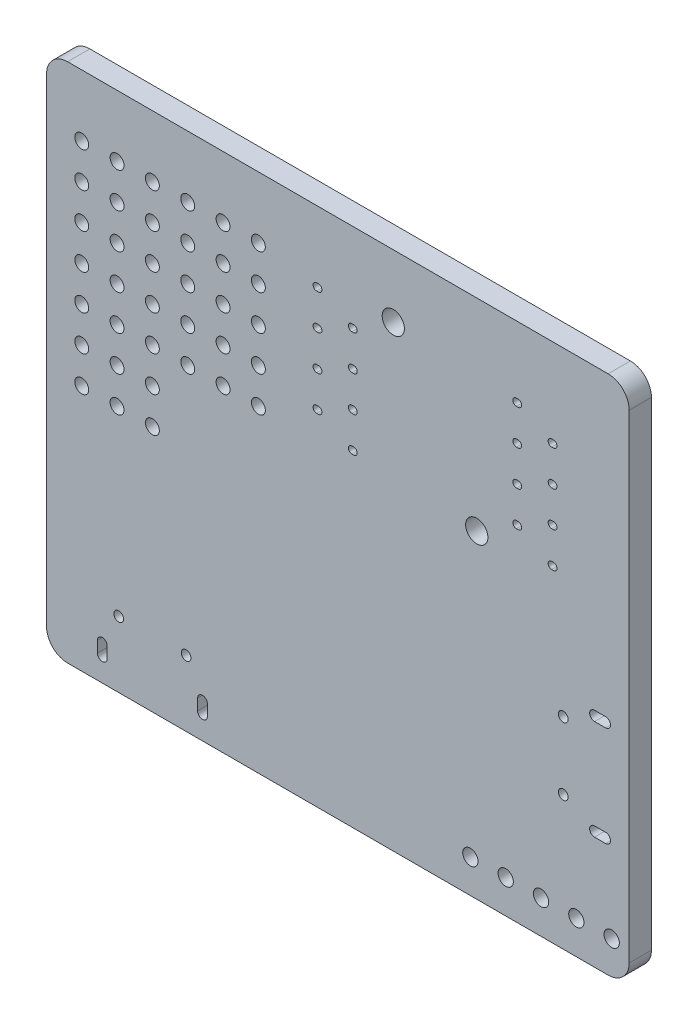
from build123d import *

# Parameters (mm, degrees)
SKETCH1_R           = 0.50000127
SKETCH1_R_2         = 0.80000254
SKETCH1_R_3         = 0.3500127
SKETCH1_R_4         = 0.5500127
BOSS_EXTRUDE1_DEPTH = 1.6000508


with BuildPart() as part:
    # Sketch1 → Boss-Extrude1 (new body)
    with BuildSketch(Plane(origin=(0, 0, 0), x_dir=(-1, 0, 0), z_dir=(0, 0, -1))):
        with BuildLine():
            Line((-40.386080772, 0.012700025), (-1.524003048, 0.012700025))
            ThreePointArc((-1.524003048, 0.012700025), (-0.455350432, 0.455350432), (-0.012700025, 1.524003048))
            Line((-0.012700025, 1.524003048), (-0.012700025, 35.941071882))
            ThreePointArc((-0.012700025, 35.941071882), (-0.455350432, 37.009724498), (-1.524003048, 37.452374905))
            Line((-1.524003048, 37.452374905), (-40.386080772, 37.452374905))
            ThreePointArc((-40.386080772, 37.452374905), (-41.454733388, 37.009724498), (-41.897383795, 35.941071882))
            Line((-41.897383795, 35.941071882), (-41.897383795, 1.524003048))
            ThreePointArc((-41.897383795, 1.524003048), (-41.454733388, 0.455350432), (-40.386080772, 0.012700025))
        make_face()
        with Locations(Location((-2.54000508, 33.02006604, 0), (0, 0, 180))):
            Circle(SKETCH1_R, mode=Mode.SUBTRACT)
        with Locations(Location((-5.08001016, 33.02006604, 0), (0, 0, 180))):
            Circle(SKETCH1_R, mode=Mode.SUBTRACT)
        with Locations(Location((-2.54000508, 30.48006096, 0), (0, 0, 180))):
            Circle(SKETCH1_R, mode=Mode.SUBTRACT)
        with Locations(Location((-5.08001016, 30.48006096, 0), (0, 0, 180))):
            Circle(SKETCH1_R, mode=Mode.SUBTRACT)
        with Locations(Location((-7.62001524, 33.02006604, 0), (0, 0, 180))):
            Circle(SKETCH1_R, mode=Mode.SUBTRACT)
        with Locations(Location((-10.16002032, 33.02006604, 0), (0, 0, 180))):
            Circle(SKETCH1_R, mode=Mode.SUBTRACT)
        with Locations(Location((-7.62001524, 30.48006096, 0), (0, 0, 180))):
            Circle(SKETCH1_R, mode=Mode.SUBTRACT)
        with Locations(Location((-10.16002032, 30.48006096, 0), (0, 0, 180))):
            Circle(SKETCH1_R, mode=Mode.SUBTRACT)
        with Locations(Location((-2.54000508, 27.94005588, 0), (0, 0, 180))):
            Circle(SKETCH1_R, mode=Mode.SUBTRACT)
        with Locations(Location((-5.08001016, 27.94005588, 0), (0, 0, 180))):
            Circle(SKETCH1_R, mode=Mode.SUBTRACT)
        with Locations(Location((-7.62001524, 27.94005588, 0), (0, 0, 180))):
            Circle(SKETCH1_R, mode=Mode.SUBTRACT)
        with Locations(Location((-10.16002032, 27.94005588, 0), (0, 0, 180))):
            Circle(SKETCH1_R, mode=Mode.SUBTRACT)
        with Locations(Location((-12.7000254, 33.02006604, 0), (0, 0, 180))):
            Circle(SKETCH1_R, mode=Mode.SUBTRACT)
        with Locations(Location((-15.24003048, 33.02006604, 0), (0, 0, 180))):
            Circle(SKETCH1_R, mode=Mode.SUBTRACT)
        with Locations(Location((-12.7000254, 30.48006096, 0), (0, 0, 180))):
            Circle(SKETCH1_R, mode=Mode.SUBTRACT)
        with Locations(Location((-15.24003048, 30.48006096, 0), (0, 0, 180))):
            Circle(SKETCH1_R, mode=Mode.SUBTRACT)
        with Locations(Location((-12.7000254, 27.94005588, 0), (0, 0, 180))):
            Circle(SKETCH1_R, mode=Mode.SUBTRACT)
        with Locations(Location((-15.24003048, 27.94005588, 0), (0, 0, 180))):
            Circle(SKETCH1_R, mode=Mode.SUBTRACT)
        with Locations(Location((-2.54000508, 25.4000508, 0), (0, 0, 180))):
            Circle(SKETCH1_R, mode=Mode.SUBTRACT)
        with Locations(Location((-5.08001016, 25.4000508, 0), (0, 0, 180))):
            Circle(SKETCH1_R, mode=Mode.SUBTRACT)
        with Locations(Location((-2.54000508, 22.86004572, 0), (0, 0, 180))):
            Circle(SKETCH1_R, mode=Mode.SUBTRACT)
        with Locations(Location((-5.08001016, 22.86004572, 0), (0, 0, 180))):
            Circle(SKETCH1_R, mode=Mode.SUBTRACT)
        with Locations(Location((-7.62001524, 25.4000508, 0), (0, 0, 180))):
            Circle(SKETCH1_R, mode=Mode.SUBTRACT)
        with Locations(Location((-10.16002032, 25.4000508, 0), (0, 0, 180))):
            Circle(SKETCH1_R, mode=Mode.SUBTRACT)
        with Locations(Location((-7.62001524, 22.86004572, 0), (0, 0, 180))):
            Circle(SKETCH1_R, mode=Mode.SUBTRACT)
        with Locations(Location((-10.16002032, 22.86004572, 0), (0, 0, 180))):
            Circle(SKETCH1_R, mode=Mode.SUBTRACT)
        with Locations(Location((-2.54000508, 20.32004064, 0), (0, 0, 180))):
            Circle(SKETCH1_R, mode=Mode.SUBTRACT)
        with Locations(Location((-5.08001016, 20.32004064, 0), (0, 0, 180))):
            Circle(SKETCH1_R, mode=Mode.SUBTRACT)
        with Locations(Location((-2.54000508, 17.78003556, 0), (0, 0, 180))):
            Circle(SKETCH1_R, mode=Mode.SUBTRACT)
        with Locations(Location((-5.08001016, 17.78003556, 0), (0, 0, 180))):
            Circle(SKETCH1_R, mode=Mode.SUBTRACT)
        with Locations(Location((-7.62001524, 20.32004064, 0), (0, 0, 180))):
            Circle(SKETCH1_R, mode=Mode.SUBTRACT)
        with Locations(Location((-7.62001524, 17.78003556, 0), (0, 0, 180))):
            Circle(SKETCH1_R, mode=Mode.SUBTRACT)
        with Locations(Location((-12.7000254, 25.4000508, 0), (0, 0, 180))):
            Circle(SKETCH1_R, mode=Mode.SUBTRACT)
        with Locations(Location((-15.24003048, 25.4000508, 0), (0, 0, 180))):
            Circle(SKETCH1_R, mode=Mode.SUBTRACT)
        with Locations(Location((-12.7000254, 22.86004572, 0), (0, 0, 180))):
            Circle(SKETCH1_R, mode=Mode.SUBTRACT)
        with Locations(Location((-15.24003048, 22.86004572, 0), (0, 0, 180))):
            Circle(SKETCH1_R, mode=Mode.SUBTRACT)
        with Locations(Location((-24.9400508, 32.94006604, 0), (0, 0, 180))):
            Circle(SKETCH1_R_2, mode=Mode.SUBTRACT)
        with Locations(Location((-30.94006096, 22.94004572, 0), (0, 0, 180))):
            Circle(SKETCH1_R_2, mode=Mode.SUBTRACT)
        with Locations(Location((-5.19502159, 4.754025908, 0), (0, 0, 180))):
            Circle(SKETCH1_R_3, mode=Mode.SUBTRACT)
        with Locations(Location((-10.04500889, 4.754025908, 0), (0, 0, 180))):
            Circle(SKETCH1_R_3, mode=Mode.SUBTRACT)
        with Locations(Location((-37.156057912, 14.49001778, 0), (0, 0, 180))):
            Circle(SKETCH1_R_3, mode=Mode.SUBTRACT)
        with Locations(Location((-37.156057912, 9.64003048, 0), (0, 0, 180))):
            Circle(SKETCH1_R_3, mode=Mode.SUBTRACT)
        with Locations(Location((-30.48006096, 2.413004826, 0), (0, 0, 180))):
            Circle(SKETCH1_R_4, mode=Mode.SUBTRACT)
        with Locations(Location((-33.02006604, 2.413004826, 0), (0, 0, 180))):
            Circle(SKETCH1_R_4, mode=Mode.SUBTRACT)
        with Locations(Location((-35.56007112, 2.413004826, 0), (0, 0, 180))):
            Circle(SKETCH1_R_4, mode=Mode.SUBTRACT)
        with Locations(Location((-38.1000762, 2.413004826, 0), (0, 0, 180))):
            Circle(SKETCH1_R_4, mode=Mode.SUBTRACT)
        with Locations(Location((-40.64008128, 2.413004826, 0), (0, 0, 180))):
            Circle(SKETCH1_R_4, mode=Mode.SUBTRACT)
        with BuildLine():
            Line((-19.553538227, 32.639065278), (-19.426537973, 32.639065278))
            ThreePointArc((-19.426537973, 32.639065278), (-19.172537465, 32.38506477), (-19.426537973, 32.131064262))
            Line((-19.426537973, 32.131064262), (-19.553538227, 32.131064262))
            ThreePointArc((-19.553538227, 32.131064262), (-19.807538735, 32.38506477), (-19.553538227, 32.639065278))
        make_face(mode=Mode.SUBTRACT)
        with BuildLine():
            Line((-19.553538227, 30.099060198), (-19.426537973, 30.099060198))
            ThreePointArc((-19.426537973, 30.099060198), (-19.172537465, 29.84505969), (-19.426537973, 29.591059182))
            Line((-19.426537973, 29.591059182), (-19.553538227, 29.591059182))
            ThreePointArc((-19.553538227, 29.591059182), (-19.807538735, 29.84505969), (-19.553538227, 30.099060198))
        make_face(mode=Mode.SUBTRACT)
        with BuildLine():
            Line((-19.553538227, 27.559055118), (-19.426537973, 27.559055118))
            ThreePointArc((-19.426537973, 27.559055118), (-19.172537465, 27.30505461), (-19.426537973, 27.051054102))
            Line((-19.426537973, 27.051054102), (-19.553538227, 27.051054102))
            ThreePointArc((-19.553538227, 27.051054102), (-19.807538735, 27.30505461), (-19.553538227, 27.559055118))
        make_face(mode=Mode.SUBTRACT)
        with BuildLine():
            Line((-19.553538227, 25.019050038), (-19.426537973, 25.019050038))
            ThreePointArc((-19.426537973, 25.019050038), (-19.172537465, 24.76504953), (-19.426537973, 24.511049022))
            Line((-19.426537973, 24.511049022), (-19.553538227, 24.511049022))
            ThreePointArc((-19.553538227, 24.511049022), (-19.807538735, 24.76504953), (-19.553538227, 25.019050038))
        make_face(mode=Mode.SUBTRACT)
        with BuildLine():
            Line((-22.093543307, 31.369062738), (-21.966543053, 31.369062738))
            ThreePointArc((-21.966543053, 31.369062738), (-21.712542545, 31.11506223), (-21.966543053, 30.861061722))
            Line((-21.966543053, 30.861061722), (-22.093543307, 30.861061722))
            ThreePointArc((-22.093543307, 30.861061722), (-22.347543815, 31.11506223), (-22.093543307, 31.369062738))
        make_face(mode=Mode.SUBTRACT)
        with BuildLine():
            Line((-22.093543307, 28.829057658), (-21.966543053, 28.829057658))
            ThreePointArc((-21.966543053, 28.829057658), (-21.712542545, 28.57505715), (-21.966543053, 28.321056642))
            Line((-21.966543053, 28.321056642), (-22.093543307, 28.321056642))
            ThreePointArc((-22.093543307, 28.321056642), (-22.347543815, 28.57505715), (-22.093543307, 28.829057658))
        make_face(mode=Mode.SUBTRACT)
        with BuildLine():
            Line((-22.093543307, 26.289052578), (-21.966543053, 26.289052578))
            ThreePointArc((-21.966543053, 26.289052578), (-21.712542545, 26.03505207), (-21.966543053, 25.781051562))
            Line((-21.966543053, 25.781051562), (-22.093543307, 25.781051562))
            ThreePointArc((-22.093543307, 25.781051562), (-22.347543815, 26.03505207), (-22.093543307, 26.289052578))
        make_face(mode=Mode.SUBTRACT)
        with BuildLine():
            Line((-33.913568707, 32.639065278), (-33.786568453, 32.639065278))
            ThreePointArc((-33.786568453, 32.639065278), (-33.532567945, 32.38506477), (-33.786568453, 32.131064262))
            Line((-33.786568453, 32.131064262), (-33.913568707, 32.131064262))
            ThreePointArc((-33.913568707, 32.131064262), (-34.167569215, 32.38506477), (-33.913568707, 32.639065278))
        make_face(mode=Mode.SUBTRACT)
        with BuildLine():
            Line((-33.913568707, 30.099060198), (-33.786568453, 30.099060198))
            ThreePointArc((-33.786568453, 30.099060198), (-33.532567945, 29.84505969), (-33.786568453, 29.591059182))
            Line((-33.786568453, 29.591059182), (-33.913568707, 29.591059182))
            ThreePointArc((-33.913568707, 29.591059182), (-34.167569215, 29.84505969), (-33.913568707, 30.099060198))
        make_face(mode=Mode.SUBTRACT)
        with BuildLine():
            Line((-36.453573787, 31.369062738), (-36.326573533, 31.369062738))
            ThreePointArc((-36.326573533, 31.369062738), (-36.072573025, 31.11506223), (-36.326573533, 30.861061722))
            Line((-36.326573533, 30.861061722), (-36.453573787, 30.861061722))
            ThreePointArc((-36.453573787, 30.861061722), (-36.707574295, 31.11506223), (-36.453573787, 31.369062738))
        make_face(mode=Mode.SUBTRACT)
        with BuildLine():
            Line((-33.913568707, 27.559055118), (-33.786568453, 27.559055118))
            ThreePointArc((-33.786568453, 27.559055118), (-33.532567945, 27.30505461), (-33.786568453, 27.051054102))
            Line((-33.786568453, 27.051054102), (-33.913568707, 27.051054102))
            ThreePointArc((-33.913568707, 27.051054102), (-34.167569215, 27.30505461), (-33.913568707, 27.559055118))
        make_face(mode=Mode.SUBTRACT)
        with BuildLine():
            Line((-36.453573787, 28.829057658), (-36.326573533, 28.829057658))
            ThreePointArc((-36.326573533, 28.829057658), (-36.072573025, 28.57505715), (-36.326573533, 28.321056642))
            Line((-36.326573533, 28.321056642), (-36.453573787, 28.321056642))
            ThreePointArc((-36.453573787, 28.321056642), (-36.707574295, 28.57505715), (-36.453573787, 28.829057658))
        make_face(mode=Mode.SUBTRACT)
        with BuildLine():
            Line((-36.453573787, 26.289052578), (-36.326573533, 26.289052578))
            ThreePointArc((-36.326573533, 26.289052578), (-36.072573025, 26.03505207), (-36.326573533, 25.781051562))
            Line((-36.326573533, 25.781051562), (-36.453573787, 25.781051562))
            ThreePointArc((-36.453573787, 25.781051562), (-36.707574295, 26.03505207), (-36.453573787, 26.289052578))
        make_face(mode=Mode.SUBTRACT)
        with BuildLine():
            Line((-22.093543307, 23.749047498), (-21.966543053, 23.749047498))
            ThreePointArc((-21.966543053, 23.749047498), (-21.712542545, 23.49504699), (-21.966543053, 23.241046482))
            Line((-21.966543053, 23.241046482), (-22.093543307, 23.241046482))
            ThreePointArc((-22.093543307, 23.241046482), (-22.347543815, 23.49504699), (-22.093543307, 23.749047498))
        make_face(mode=Mode.SUBTRACT)
        with BuildLine():
            Line((-33.913568707, 25.019050038), (-33.786568453, 25.019050038))
            ThreePointArc((-33.786568453, 25.019050038), (-33.532567945, 24.76504953), (-33.786568453, 24.511049022))
            Line((-33.786568453, 24.511049022), (-33.913568707, 24.511049022))
            ThreePointArc((-33.913568707, 24.511049022), (-34.167569215, 24.76504953), (-33.913568707, 25.019050038))
        make_face(mode=Mode.SUBTRACT)
        with BuildLine():
            Line((-36.453573787, 23.749047498), (-36.326573533, 23.749047498))
            ThreePointArc((-36.326573533, 23.749047498), (-36.072573025, 23.49504699), (-36.326573533, 23.241046482))
            Line((-36.326573533, 23.241046482), (-36.453573787, 23.241046482))
            ThreePointArc((-36.453573787, 23.241046482), (-36.707574295, 23.49504699), (-36.453573787, 23.749047498))
        make_face(mode=Mode.SUBTRACT)
        with BuildLine():
            Line((-3.67007874, 2.504038608), (-3.67007874, 1.703937008))
            ThreePointArc((-3.67007874, 1.703937008), (-4.02009144, 1.353924308), (-4.37010414, 1.703937008))
            Line((-4.37010414, 1.703937008), (-4.37010414, 2.504038608))
            ThreePointArc((-4.37010414, 2.504038608), (-4.02009144, 2.854051308), (-3.67007874, 2.504038608))
        make_face(mode=Mode.SUBTRACT)
        with BuildLine():
            Line((-10.86992634, 2.504038608), (-10.86992634, 1.703937008))
            ThreePointArc((-10.86992634, 1.703937008), (-11.21993904, 1.353924308), (-11.56995174, 1.703937008))
            Line((-11.56995174, 1.703937008), (-11.56995174, 2.504038608))
            ThreePointArc((-11.56995174, 2.504038608), (-11.21993904, 2.854051308), (-10.86992634, 2.504038608))
        make_face(mode=Mode.SUBTRACT)
        with BuildLine():
            Line((-40.206146812, 16.01496063), (-39.406045212, 16.01496063))
            ThreePointArc((-39.406045212, 16.01496063), (-39.056032512, 15.66494793), (-39.406045212, 15.31493523))
            Line((-39.406045212, 15.31493523), (-40.206146812, 15.31493523))
            ThreePointArc((-40.206146812, 15.31493523), (-40.556159512, 15.66494793), (-40.206146812, 16.01496063))
        make_face(mode=Mode.SUBTRACT)
        with BuildLine():
            Line((-40.206146812, 8.81511303), (-39.406045212, 8.81511303))
            ThreePointArc((-39.406045212, 8.81511303), (-39.056032512, 8.46510033), (-39.406045212, 8.11508763))
            Line((-39.406045212, 8.11508763), (-40.206146812, 8.11508763))
            ThreePointArc((-40.206146812, 8.11508763), (-40.556159512, 8.46510033), (-40.206146812, 8.81511303))
        make_face(mode=Mode.SUBTRACT)
    extrude(amount=-BOSS_EXTRUDE1_DEPTH)


solid = part.part
